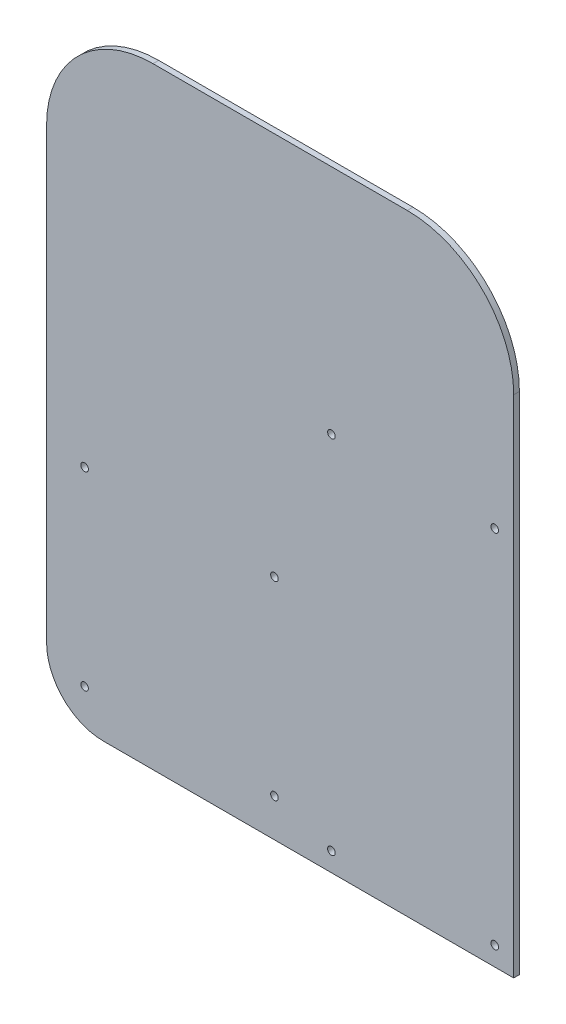
from build123d import *

# Parameters (mm, degrees)
CROQUIS2_R              = 2
SALIENTE_EXTRUIR2_DEPTH = 3


with BuildPart() as part:
    # Croquis2 → Saliente-Extruir2 (new body)
    with BuildSketch(Plane.XY):
        with BuildLine():
            Line((0, 0), (0, 80))
            Line((0, 80), (0, 235.988905846))
            ThreePointArc((0, 235.988905846), (16.416079704, 275.620828109), (56.048001966, 292.036907812))
            Line((56.048001966, 292.036907812), (189.951998034, 292.036907812))
            ThreePointArc((189.951998034, 292.036907812), (229.583920296, 275.620828109), (246, 235.988905846))
            Line((246, 235.988905846), (246, 180))
            Line((246, 180), (246, -30))
            Line((246, -30), (140, -30))
            Line((140, -30), (110, -30))
            Line((110, -30), (30, -30))
            ThreePointArc((30, -30), (8.786796564, -21.213203436), (0, 0))
        make_face()
        with Locations((20, -10)):
            Circle(CROQUIS2_R, mode=Mode.SUBTRACT)
        with Locations(Location((120, -10, 0), (0, 0, 180))):
            Circle(CROQUIS2_R, mode=Mode.SUBTRACT)
        with Locations((120, 90)):
            Circle(CROQUIS2_R, mode=Mode.SUBTRACT)
        with Locations(Location((20, 90, 0), (0, 0, 180))):
            Circle(CROQUIS2_R, mode=Mode.SUBTRACT)
        with Locations((150, 170)):
            Circle(CROQUIS2_R, mode=Mode.SUBTRACT)
        with Locations(Location((236, 170, 0), (0, 0, 180))):
            Circle(CROQUIS2_R, mode=Mode.SUBTRACT)
        with Locations((236, -20)):
            Circle(CROQUIS2_R, mode=Mode.SUBTRACT)
        with Locations(Location((150, -20, 0), (0, 0, 180))):
            Circle(CROQUIS2_R, mode=Mode.SUBTRACT)
    extrude(amount=SALIENTE_EXTRUIR2_DEPTH)


solid = part.part
